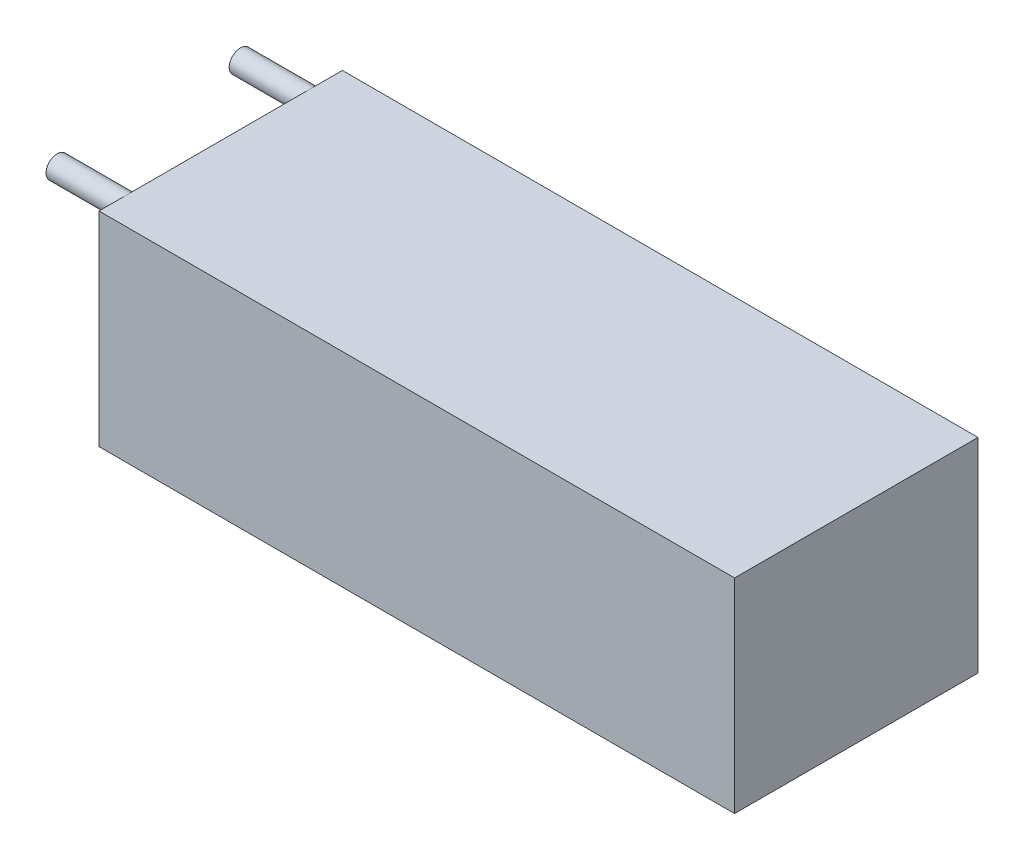
from build123d import *

# Parameters (mm, degrees)
SKETCH_1_W      = 135
SKETCH_1_H      = 51.7
EXTRUDE_1_DEPTH = 43.34
SKETCH_2_R      = 1.086280141
SKETCH_2_R_2    = 2.372753638
SKETCH_2_R_3    = 2.361962499
EXTRUDE_2_DEPTH = 15


with BuildPart() as part:
    # 草图1 → 凸台-拉伸1 (new body)
    with BuildSketch(Plane(origin=(0, 0, 0), x_dir=(1, 0, 0), z_dir=(0, 1, 0))):
        with Locations((67.5, 25.85)):
            Rectangle(SKETCH_1_W, SKETCH_1_H)
    extrude(amount=EXTRUDE_1_DEPTH)

    # 草图2 → 凸台-拉伸2 (add)
    with BuildSketch(Plane.ZY):
        with Locations((-33.248816044, 1.972664588)):
            Circle(SKETCH_2_R)
        with Locations((-45.037596274, 40.939762419)):
            Circle(SKETCH_2_R_2)
        with Locations((-6.119823883, 40.939762419)):
            Circle(SKETCH_2_R_3)
        with Locations((-30.248816044, 1.972664588)):
            Circle(SKETCH_2_R)
        with Locations((-27.248816044, 1.972664588)):
            Circle(SKETCH_2_R)
        with Locations((-24.248816044, 1.972664588)):
            Circle(SKETCH_2_R)
        with Locations((-21.248816044, 1.972664588)):
            Circle(SKETCH_2_R)
        with Locations((-18.248816044, 1.972664588)):
            Circle(SKETCH_2_R)
    extrude(amount=EXTRUDE_2_DEPTH)


solid = part.part
